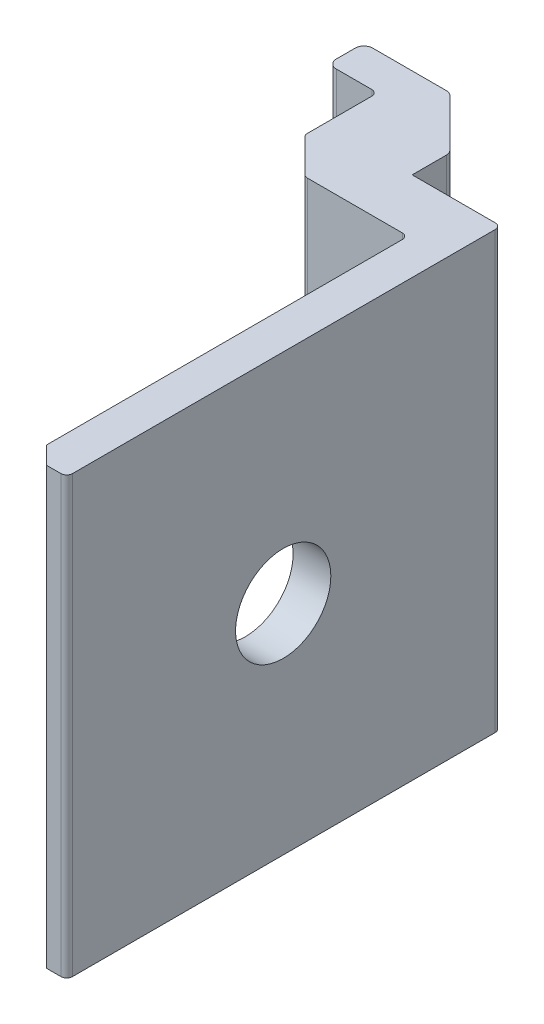
from build123d import *

# Parameters (mm, degrees)
BOSS_EXTRUDE1_DEPTH = 38.1
SKETCH2_W           = 3.175
SKETCH2_H           = 38.1
BOSS_EXTRUDE2_DEPTH = 4.3688
HOLE1_D             = 8.3312
HOLE1_DEPTH         = 19.862825
FILLET1_R           = 0.508
FILLET2_R           = 0.762


with BuildPart() as part:
    # Sketch1 → Boss-Extrude1 (new body)
    with BuildSketch(Plane(origin=(0, 0, 0), x_dir=(1, 0, 0), z_dir=(0, 1, 0))):
        Polygon((-12.236871502, 8.069451482), (-15.386471502, 8.069451482), (-15.386471502, -1.455548518), (-12.211471502, -4.630548518), (-3.194471502, -4.630548518), (-3.194471502, -36.263708518), (-1.670471502, -37.787708518), (0.107528498, -37.787708518), (0.107528498, 0.195451482), (-7.664871502, 0.195451482), (-7.664871502, 3.497451482), align=None)
    extrude(amount=-BOSS_EXTRUDE1_DEPTH)

    # Sketch2 → Boss-Extrude2 (add)
    with BuildSketch(Plane.ZY.offset(15.386471502)):
        with Locations((-6.481951482, -19.05)):
            Rectangle(SKETCH2_W, SKETCH2_H)
    extrude(amount=BOSS_EXTRUDE2_DEPTH)

    # Hole1
    with Locations(Plane(origin=(0.107528498, 0, 0), x_dir=(0, 0, -1), z_dir=(1, 0, 0))):
        with Locations((-18.854548518, -19.05)):
            Hole(HOLE1_D / 2, depth=HOLE1_DEPTH)

    # Fillet1
    fillet1_edges = [part.edges().sort_by_distance(p)[0] for p in [
        (-15.386471502, -19.05, -4.894451482),
        (0.107528498, -19.05, -0.195451482),
        (0.107528498, -19.05, 37.787708518),
        (-12.211471502, -19.05, 4.630548518),
        (-3.194471502, -19.05, 4.630548518),
        (-15.386471502, -19.05, 1.455548518),
    ]]
    fillet(fillet1_edges, radius=FILLET1_R)

    # Fillet2
    fillet2_edges = [part.edges().sort_by_distance(p)[0] for p in [
        (-7.664871502, -19.05, -3.497451482),
        (-19.755271502, -19.05, -4.894451482),
        (-19.755271502, -19.05, -8.069451482),
        (-12.236871502, -19.05, -8.069451482),
    ]]
    fillet(fillet2_edges, radius=FILLET2_R)


solid = part.part
